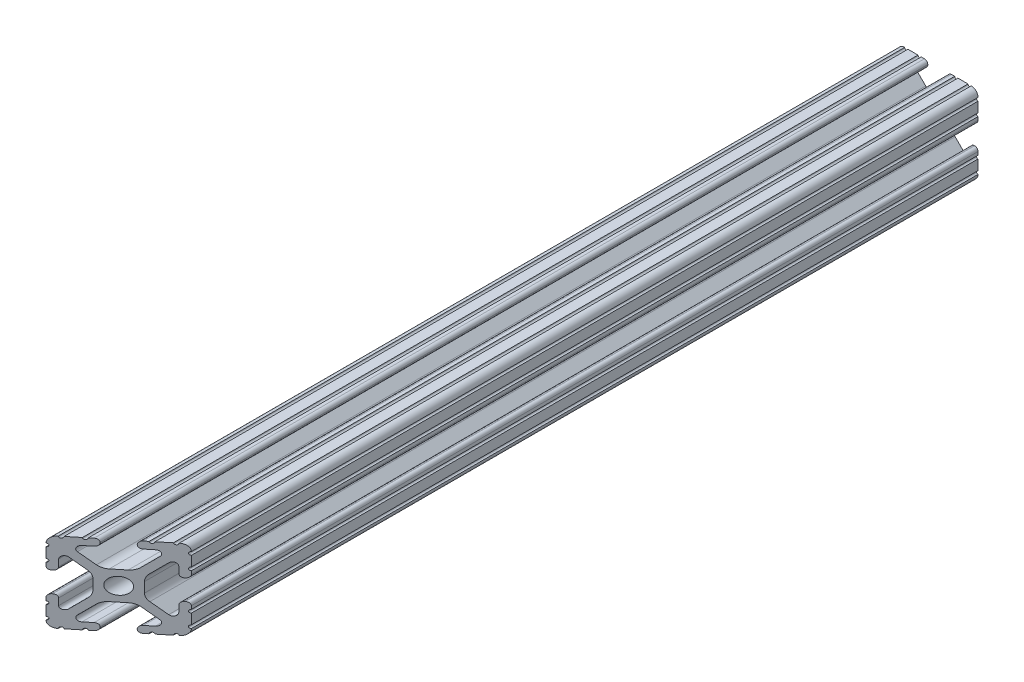
from build123d import *

# Parameters (mm, degrees)
SKETCH1_R           = 2.6035
BOSS_EXTRUDE1_DEPTH = 144.78
CUT_EXTRUDE1_DEPTH  = 148.538803032


with BuildPart() as part:
    # Sketch1 → Boss-Extrude1 (new, symmetric)
    with BuildSketch(Plane.XY):
        with BuildLine():
            Line((-7.179650497, -8.645192506), (-3.952270251, -5.423690499))
            ThreePointArc((-3.952270251, -5.423690499), (-2.922936451, -4.736929036), (-1.709253557, -4.4958))
            Line((-1.709253557, -4.4958), (1.709253557, -4.4958))
            ThreePointArc((1.709253557, -4.4958), (2.922936451, -4.736929036), (3.952270251, -5.423690499))
            Line((3.952270251, -5.423690499), (7.179650497, -8.645192506))
            ThreePointArc((7.179650497, -8.645192506), (7.41473083, -9.822813117), (6.416408329, -10.4902))
            Line((6.416408329, -10.4902), (4.287512407, -10.4902))
            ThreePointArc((4.287512407, -10.4902), (3.54574862, -10.79744862), (3.2385, -11.539212407))
            Line((3.2385, -11.539212407), (3.2385, -11.650987593))
            ThreePointArc((3.2385, -11.650987593), (3.54574862, -12.39275138), (4.287512407, -12.7))
            Line((4.287512407, -12.7), (5.317126718, -12.7))
            ThreePointArc((5.317126718, -12.7), (5.825126718, -12.192), (6.333126718, -12.7))
            Line((6.333126718, -12.7), (9.550443118, -12.7))
            ThreePointArc((9.550443118, -12.7), (10.058366869, -12.192000006), (10.566443095, -12.699847501))
            ThreePointArc((10.566443095, -12.699847501), (12.082537762, -12.08250727), (12.699846982, -10.566399977))
            ThreePointArc((12.699846982, -10.566399977), (12.192000006, -10.058323491), (12.7, -9.5504))
            Line((12.7, -9.5504), (12.7, -6.3330836))
            ThreePointArc((12.7, -6.3330836), (12.192, -5.8250836), (12.7, -5.3170836))
            Line((12.7, -5.3170836), (12.7, -4.287469289))
            ThreePointArc((12.7, -4.287469289), (12.39275138, -3.545705502), (11.650987593, -3.238456882))
            Line((11.650987593, -3.238456882), (11.539212407, -3.238456882))
            ThreePointArc((11.539212407, -3.238456882), (10.79744862, -3.545705502), (10.4902, -4.287469289))
            Line((10.4902, -4.287469289), (10.4902, -6.402089023))
            ThreePointArc((10.4902, -6.402089023), (9.856505071, -7.351067942), (8.737131347, -7.129408934))
            Line((8.737131347, -7.129408934), (5.441005833, -3.840816462))
            ThreePointArc((5.441005833, -3.840816462), (4.750877967, -2.809883091), (4.5085, -1.593185507))
            Line((4.5085, -1.593185507), (4.5085, 1.593185507))
            ThreePointArc((4.5085, 1.593185507), (4.750877967, 2.809883091), (5.441005833, 3.840816462))
            Line((5.441005833, 3.840816462), (8.737131347, 7.129408934))
            ThreePointArc((8.737131347, 7.129408934), (9.856505071, 7.351067942), (10.4902, 6.402089023))
            Line((10.4902, 6.402089023), (10.4902, 4.287469289))
            ThreePointArc((10.4902, 4.287469289), (10.79744862, 3.545705502), (11.539212407, 3.238456882))
            Line((11.539212407, 3.238456882), (11.650987593, 3.238456882))
            ThreePointArc((11.650987593, 3.238456882), (12.39275138, 3.545705502), (12.7, 4.287469289))
            Line((12.7, 4.287469289), (12.7, 5.3170836))
            ThreePointArc((12.7, 5.3170836), (12.192, 5.8250836), (12.7, 6.3330836))
            Line((12.7, 6.3330836), (12.7, 9.5504))
            ThreePointArc((12.7, 9.5504), (12.192000006, 10.058323491), (12.699846982, 10.566399977))
            ThreePointArc((12.699846982, 10.566399977), (12.082537762, 12.08250727), (10.566443095, 12.699847501))
            ThreePointArc((10.566443095, 12.699847501), (10.058366869, 12.192000006), (9.550443118, 12.7))
            Line((9.550443118, 12.7), (6.333126718, 12.7))
            ThreePointArc((6.333126718, 12.7), (5.825126718, 12.192), (5.317126718, 12.7))
            Line((5.317126718, 12.7), (4.287512407, 12.7))
            ThreePointArc((4.287512407, 12.7), (3.54574862, 12.39275138), (3.2385, 11.650987593))
            Line((3.2385, 11.650987593), (3.2385, 11.539212407))
            ThreePointArc((3.2385, 11.539212407), (3.54574862, 10.79744862), (4.287512407, 10.4902))
            Line((4.287512407, 10.4902), (6.476788598, 10.4902))
            ThreePointArc((6.476788598, 10.4902), (7.432222385, 9.85140422), (7.207036008, 8.724370562))
            Line((7.207036008, 8.724370562), (3.898272566, 5.423169045))
            ThreePointArc((3.898272566, 5.423169045), (2.869120213, 4.736787962), (1.655778399, 4.4958))
            Line((1.655778399, 4.4958), (-1.655778399, 4.4958))
            ThreePointArc((-1.655778399, 4.4958), (-2.869120213, 4.736787962), (-3.898272566, 5.423169045))
            Line((-3.898272566, 5.423169045), (-7.207036008, 8.724370562))
            ThreePointArc((-7.207036008, 8.724370562), (-7.432222385, 9.85140422), (-6.476788598, 10.4902))
            Line((-6.476788598, 10.4902), (-4.287512407, 10.4902))
            ThreePointArc((-4.287512407, 10.4902), (-3.54574862, 10.79744862), (-3.2385, 11.539212407))
            Line((-3.2385, 11.539212407), (-3.2385, 11.650987593))
            ThreePointArc((-3.2385, 11.650987593), (-3.54574862, 12.39275138), (-4.287512407, 12.7))
            Line((-4.287512407, 12.7), (-5.317126718, 12.7))
            ThreePointArc((-5.317126718, 12.7), (-5.825126718, 12.192), (-6.333126718, 12.7))
            Line((-6.333126718, 12.7), (-9.550443118, 12.7))
            ThreePointArc((-9.550443118, 12.7), (-10.058366869, 12.192000006), (-10.566443095, 12.699847501))
            ThreePointArc((-10.566443095, 12.699847501), (-12.082537762, 12.08250727), (-12.699846982, 10.566399977))
            ThreePointArc((-12.699846982, 10.566399977), (-12.192000006, 10.058323491), (-12.7, 9.5504))
            Line((-12.7, 9.5504), (-12.7, 6.3330836))
            ThreePointArc((-12.7, 6.3330836), (-12.192, 5.8250836), (-12.7, 5.3170836))
            Line((-12.7, 5.3170836), (-12.7, 4.287469289))
            ThreePointArc((-12.7, 4.287469289), (-12.39275138, 3.545705502), (-11.650987593, 3.238456882))
            Line((-11.650987593, 3.238456882), (-11.539212407, 3.238456882))
            ThreePointArc((-11.539212407, 3.238456882), (-10.79744862, 3.545705502), (-10.4902, 4.287469289))
            Line((-10.4902, 4.287469289), (-10.4902, 6.402089023))
            ThreePointArc((-10.4902, 6.402089023), (-9.856505071, 7.351067942), (-8.737131347, 7.129408934))
            Line((-8.737131347, 7.129408934), (-5.441005833, 3.840816462))
            ThreePointArc((-5.441005833, 3.840816462), (-4.750877967, 2.809883091), (-4.5085, 1.593185507))
            Line((-4.5085, 1.593185507), (-4.5085, -1.593185507))
            ThreePointArc((-4.5085, -1.593185507), (-4.750877967, -2.809883091), (-5.441005833, -3.840816462))
            Line((-5.441005833, -3.840816462), (-8.737131347, -7.129408934))
            ThreePointArc((-8.737131347, -7.129408934), (-9.856505071, -7.351067942), (-10.4902, -6.402089023))
            Line((-10.4902, -6.402089023), (-10.4902, -4.287469289))
            ThreePointArc((-10.4902, -4.287469289), (-10.79744862, -3.545705502), (-11.539212407, -3.238456882))
            Line((-11.539212407, -3.238456882), (-11.650987593, -3.238456882))
            ThreePointArc((-11.650987593, -3.238456882), (-12.39275138, -3.545705502), (-12.7, -4.287469289))
            Line((-12.7, -4.287469289), (-12.7, -5.3170836))
            ThreePointArc((-12.7, -5.3170836), (-12.192, -5.8250836), (-12.7, -6.3330836))
            Line((-12.7, -6.3330836), (-12.7, -9.5504))
            ThreePointArc((-12.7, -9.5504), (-12.192000006, -10.058323491), (-12.699846982, -10.566399977))
            ThreePointArc((-12.699846982, -10.566399977), (-12.082537762, -12.08250727), (-10.566443095, -12.699847501))
            ThreePointArc((-10.566443095, -12.699847501), (-10.058366869, -12.192000006), (-9.550443118, -12.7))
            Line((-9.550443118, -12.7), (-6.333126718, -12.7))
            ThreePointArc((-6.333126718, -12.7), (-5.825126718, -12.192), (-5.317126718, -12.7))
            Line((-5.317126718, -12.7), (-4.287512407, -12.7))
            ThreePointArc((-4.287512407, -12.7), (-3.54574862, -12.39275138), (-3.2385, -11.650987593))
            Line((-3.2385, -11.650987593), (-3.2385, -11.539212407))
            ThreePointArc((-3.2385, -11.539212407), (-3.54574862, -10.79744862), (-4.287512407, -10.4902))
            Line((-4.287512407, -10.4902), (-6.416408329, -10.4902))
            ThreePointArc((-6.416408329, -10.4902), (-7.41473083, -9.822813117), (-7.179650497, -8.645192506))
        make_face()
        Circle(SKETCH1_R, mode=Mode.SUBTRACT)
    extrude(amount=BOSS_EXTRUDE1_DEPTH, both=True)

    # Sketch2 → Cut-Extrude1 (cut, through all)
    with BuildSketch(Plane(origin=(0, 12.7, 0), x_dir=(1, 0, 0), z_dir=(0, 1, 0))):
        Polygon((12.7, -144.78), (-12.7, -144.78), (-12.7, -125.571593893), (12.7, -104.831193661), align=None)
    extrude(amount=-CUT_EXTRUDE1_DEPTH, mode=Mode.SUBTRACT)


solid = part.part
